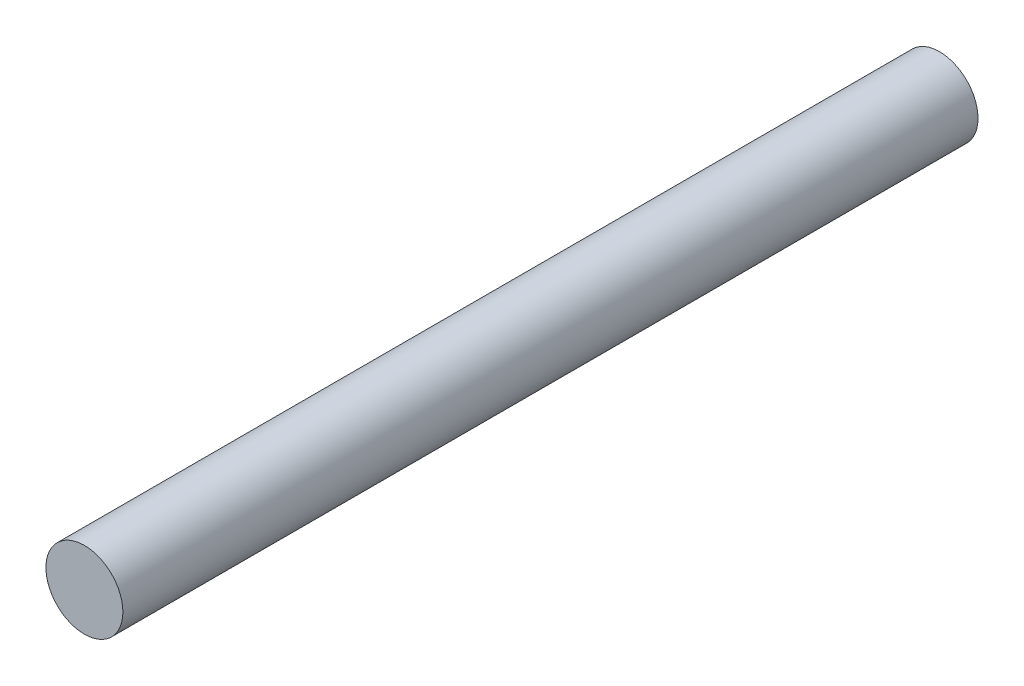
from build123d import *

# Parameters (mm, degrees)
SKETCH1_R           = 1.8
BOSS_EXTRUDE1_DEPTH = 40


with BuildPart() as part:
    # Sketch1 → Boss-Extrude1 (new body)
    with BuildSketch(Plane.XY):
        Circle(SKETCH1_R)
    extrude(amount=BOSS_EXTRUDE1_DEPTH)


solid = part.part
